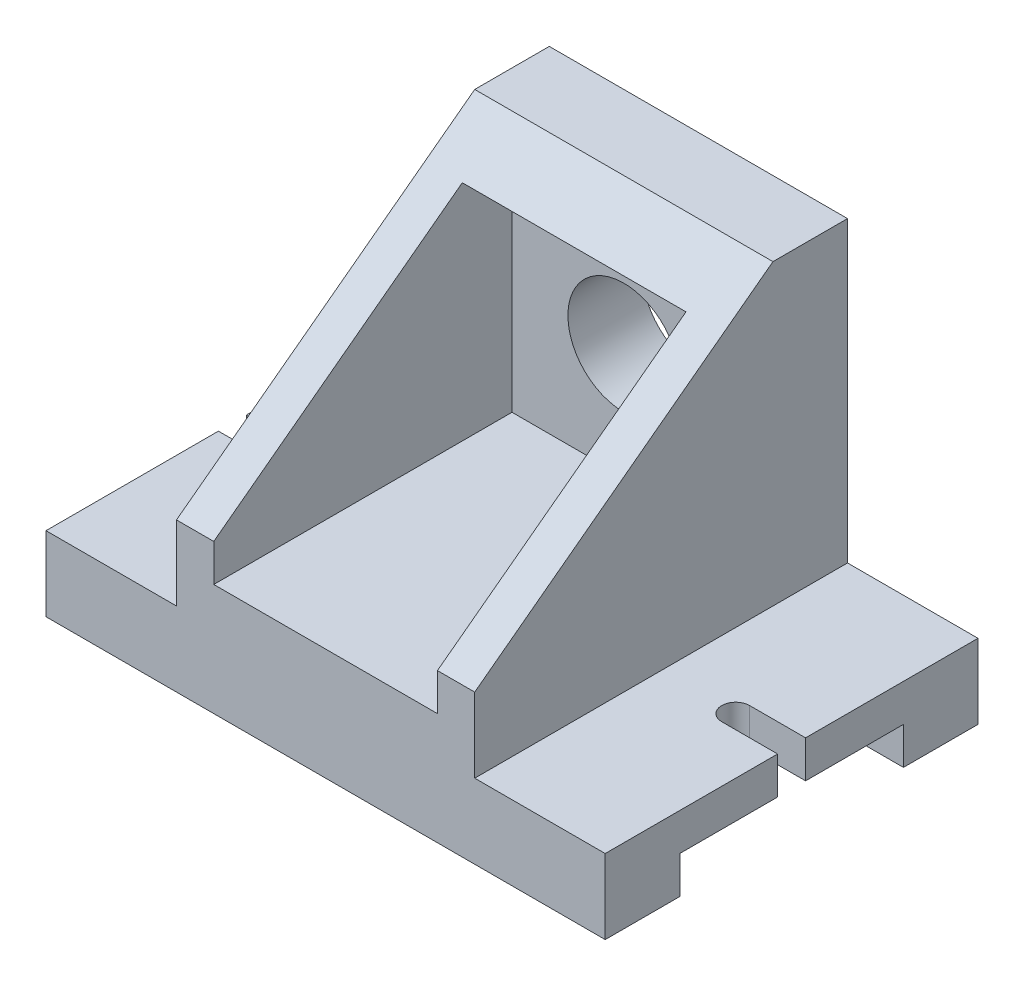
from build123d import *

# Parameters (mm, degrees)
BOSS_EXTRUDE1_DEPTH      = 75
BOSS_EXTRUDE1_DEPTH_BACK = 75
SKETCH1_W                = 100
SKETCH1_H                = 100
SKETCH2_W                = 35
SKETCH2_H                = 100
CUT_EXTRUDE1_DEPTH       = 80
CUT_EXTRUDE2_DEPTH       = 136
SKETCH5_W                = 60
SKETCH5_H                = 60
CUT_EXTRUDE3_DEPTH       = 80
SKETCH6_W                = 60
SKETCH6_H                = 10
CUT_EXTRUDE5_DEPTH       = 166.831239518
CUT_EXTRUDE6_DEPTH       = 121.519707932
HOLE1_D                  = 30


with BuildPart() as part:
    # Sketch1 → Boss-Extrude1 (new, two sides: drawn at the far end of the back side and taken through both)
    with BuildSketch(Plane(origin=(0, 0, 0), x_dir=(0, 0, -1), z_dir=(1, 0, 0)).offset(-BOSS_EXTRUDE1_DEPTH_BACK)):
        Rectangle(SKETCH1_W, SKETCH1_H)
    extrude(amount=BOSS_EXTRUDE1_DEPTH + BOSS_EXTRUDE1_DEPTH_BACK)

    # Sketch2 → Cut-Extrude1 (cut)
    with BuildSketch(Plane(origin=(0, 50, 0), x_dir=(1, 0, 0), z_dir=(0, 1, 0))):
        with Locations((57.5, 0)):
            Rectangle(SKETCH2_W, SKETCH2_H)
        with Locations((-57.5, 0)):
            Rectangle(SKETCH2_W, SKETCH2_H)
    extrude(amount=-CUT_EXTRUDE1_DEPTH, mode=Mode.SUBTRACT)

    # Sketch3 → Cut-Extrude2 (cut, through all)
    with BuildSketch(Plane(origin=(40, 0, 0), x_dir=(0, 0, -1), z_dir=(1, 0, 0))):
        Polygon((30, 50), (-50, -10), (-50, 50), align=None)
    extrude(amount=-CUT_EXTRUDE2_DEPTH, mode=Mode.SUBTRACT)

    # Sketch5 → Cut-Extrude3 (cut)
    with BuildSketch(Plane.XY.offset(50)):
        with Locations((0, 10)):
            Rectangle(SKETCH5_W, SKETCH5_H)
    extrude(amount=-CUT_EXTRUDE3_DEPTH, mode=Mode.SUBTRACT)

    # Sketch6 → Cut-Extrude5 (cut, through all)
    with BuildSketch(Plane(origin=(75, 0, 0), x_dir=(0, 0, -1), z_dir=(1, 0, 0))):
        with Locations((0, -45)):
            Rectangle(SKETCH6_W, SKETCH6_H)
    extrude(amount=-CUT_EXTRUDE5_DEPTH, mode=Mode.SUBTRACT)

    # Sketch7 → Cut-Extrude6 (cut, through all)
    with BuildSketch(Plane(origin=(0, -30, 0), x_dir=(1, 0, 0), z_dir=(0, 1, 0))):
        with BuildLine():
            Line((59.99999901, 3.75), (75, 3.75))
            Line((75, 3.75), (75, -3.75))
            Line((75, -3.75), (60, -3.75))
            ThreePointArc((60, -3.75), (56.25, -4.95e-07), (59.99999901, 3.75))
        make_face()
    cut_extrude6 = extrude(amount=-CUT_EXTRUDE6_DEPTH, mode=Mode.SUBTRACT)

    # Mirror1: Cut-Extrude6 across plane
    add(cut_extrude6.mirror(Plane(origin=(0, 0, 0), x_dir=(0, 0, 1), z_dir=(1, 0, 0))), mode=Mode.SUBTRACT)

    # Hole1 (through all)
    with Locations(Plane.XY.offset(-30)):
        with Locations((0, 10)):
            Hole(HOLE1_D / 2)


solid = part.part
